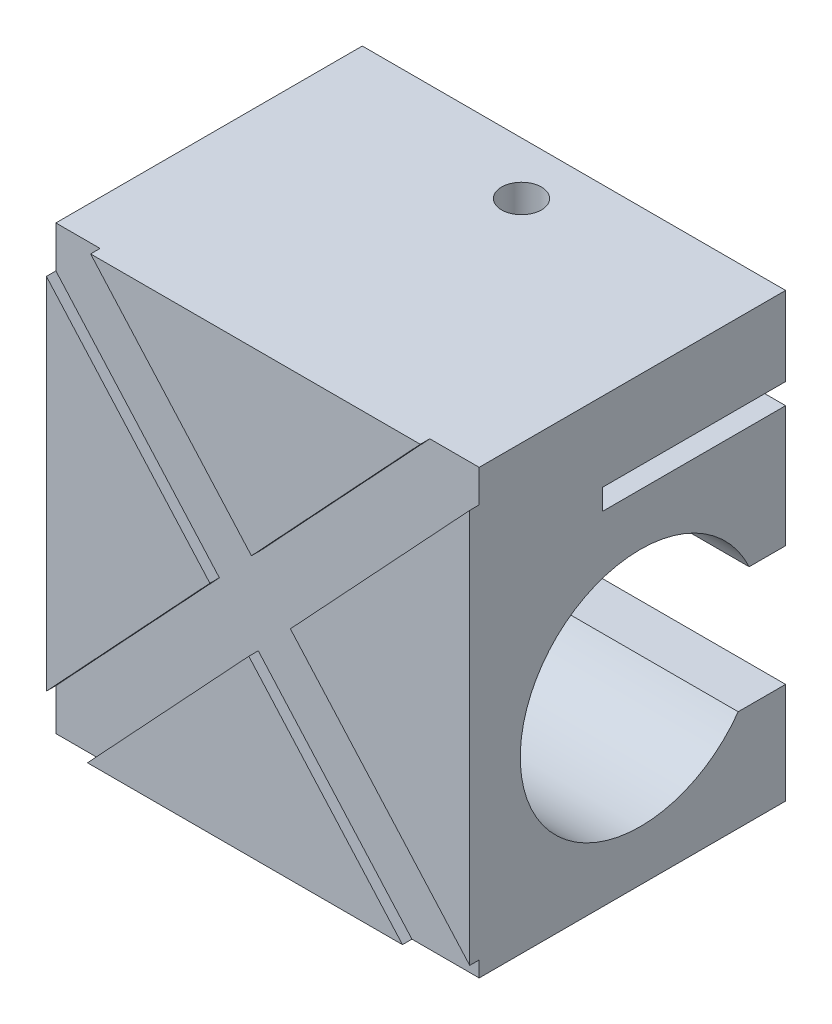
from build123d import *

# Parameters (mm, degrees)
SKETCH1_W           = 67
SKETCH1_H           = 50
BOSS_EXTRUDE1_DEPTH = 70
SKETCH2_R           = 19
CUT_EXTRUDE1_DEPTH  = 70
CUT_EXTRUDE2_DEPTH  = 70
SKETCH4_W           = 29
SKETCH4_H           = 3.3
CUT_EXTRUDE3_DEPTH  = 70
SKETCH5_R           = 3.15
CUT_EXTRUDE4_DEPTH  = 12.5
CUT_EXTRUDE6_DEPTH  = 1.5
CUT_EXTRUDE7_DEPTH  = 1.5


with BuildPart() as part:
    # Sketch1 → Boss-Extrude1 (new body)
    with BuildSketch(Plane(origin=(0, 0, 0), x_dir=(1, 0, 0), z_dir=(0, 1, 0))):
        with Locations((33.5, -25)):
            Rectangle(SKETCH1_W, SKETCH1_H)
    extrude(amount=BOSS_EXTRUDE1_DEPTH)

    # Sketch2 → Cut-Extrude1 (cut)
    with BuildSketch(Plane(origin=(67, 0, 0), x_dir=(0, 0, -1), z_dir=(1, 0, 0))):
        with Locations((-23, 27)):
            Circle(SKETCH2_R)
    extrude(amount=-CUT_EXTRUDE1_DEPTH, mode=Mode.SUBTRACT)

    # Sketch3 → Cut-Extrude2 (cut)
    with BuildSketch(Plane(origin=(67, 0, 0), x_dir=(0, 0, -1), z_dir=(1, 0, 0))):
        Polygon((0, 25.5), (0, 35), (-5.76631206, 35), (-4, 27), (-7.506256635, 16.002549544), (0, 16), align=None)
    extrude(amount=-CUT_EXTRUDE2_DEPTH, mode=Mode.SUBTRACT)

    # Sketch4 → Cut-Extrude3 (cut)
    with BuildSketch(Plane(origin=(67, 0, 0), x_dir=(0, 0, -1), z_dir=(1, 0, 0))):
        with Locations((-14.5, 55.85)):
            Rectangle(SKETCH4_W, SKETCH4_H)
    extrude(amount=-CUT_EXTRUDE3_DEPTH, mode=Mode.SUBTRACT)

    # Sketch5 → Cut-Extrude4 (cut)
    with BuildSketch(Plane(origin=(0, 70, 0), x_dir=(1, 0, 0), z_dir=(0, 1, 0))):
        with Locations(Location((33.5, -8.3, 0), (0, 0, 270))):
            Circle(SKETCH5_R)
    extrude(amount=-CUT_EXTRUDE4_DEPTH, mode=Mode.SUBTRACT)

    # Sketch6 → Cut-Extrude6 (cut)
    with BuildSketch(Plane.XY.offset(50)):
        Polygon((0, 63.425021167), (56.359161664, 0), (67, 0), (67, 2.477681398), (7, 70), (0, 70), align=None)
    extrude(amount=-CUT_EXTRUDE6_DEPTH, mode=Mode.SUBTRACT)

    # Sketch7 → Cut-Extrude7 (cut)
    with BuildSketch(Plane.XY.offset(50)):
        Polygon((0, 6.564878252), (59.179714273, 70), (67, 70), (67, 64.848472441), (6.501746598, 0), (0, 0), align=None)
    extrude(amount=-CUT_EXTRUDE7_DEPTH, mode=Mode.SUBTRACT)


solid = part.part
